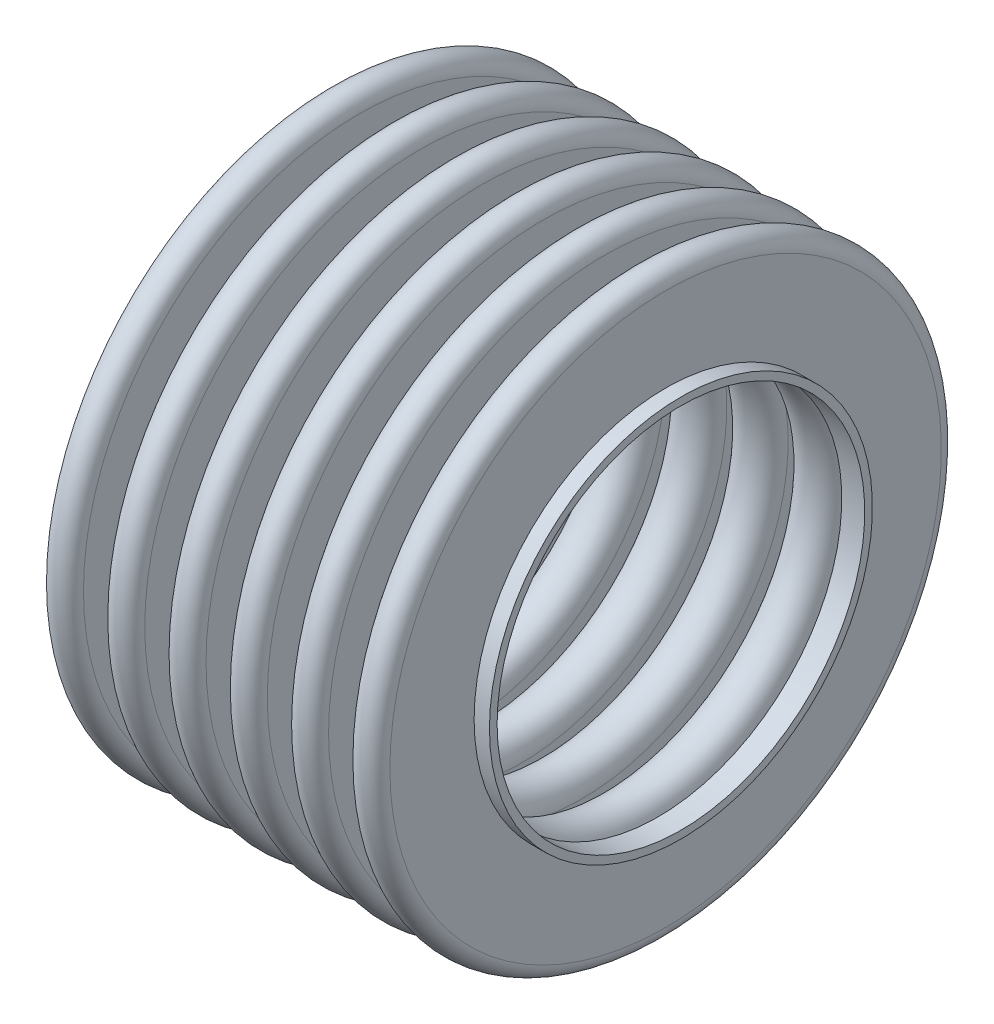
from build123d import *


with BuildPart() as part:
    # Sketch1 → Revolve1 (revolve)
    with BuildSketch(Plane.XY, mode=Mode.PRIVATE) as revolve1_sk:
        with BuildLine():
            Line((10, 6.25), (10, 6))
            Line((10, 6), (10.75, 6))
            Line((10.75, 6), (10.75, 9))
            ThreePointArc((10.75, 9), (11, 9.25), (11.25, 9))
            Line((11.25, 9), (11.25, 6.75))
            ThreePointArc((11.25, 6.75), (12, 6), (12.75, 6.75))
            Line((12.75, 6.75), (12.75, 9))
            ThreePointArc((12.75, 9), (13, 9.25), (13.25, 9))
            Line((13.25, 9), (13.25, 6.75))
            ThreePointArc((13.25, 6.75), (14, 6), (14.75, 6.75))
            Line((14.75, 6.75), (14.75, 9))
            ThreePointArc((14.75, 9), (15, 9.25), (15.25, 9))
            Line((15.25, 9), (15.25, 6.75))
            ThreePointArc((15.25, 6.75), (16, 6), (16.75, 6.75))
            Line((16.75, 6.75), (16.75, 9))
            ThreePointArc((16.75, 9), (17, 9.25), (17.25, 9))
            Line((17.25, 9), (17.25, 6.75))
            ThreePointArc((17.25, 6.75), (18, 6), (18.75, 6.75))
            Line((18.75, 6.75), (18.75, 9))
            ThreePointArc((18.75, 9), (19, 9.25), (19.25, 9))
            Line((19.25, 9), (19.25, 6.75))
            ThreePointArc((19.25, 6.75), (20, 6), (20.75, 6.75))
            Line((20.75, 6.75), (20.75, 9))
            ThreePointArc((20.75, 9), (21, 9.25), (21.25, 9))
            Line((21.25, 9), (21.25, 6))
            Line((21.25, 6), (22, 6))
            Line((22, 6), (22, 6.25))
            Line((22, 6.25), (21.5, 6.25))
            Line((21.5, 6.25), (21.5, 9))
            ThreePointArc((21.5, 9), (21, 9.5), (20.5, 9))
            Line((20.5, 9), (20.5, 6.75))
            ThreePointArc((20.5, 6.75), (20, 6.25), (19.5, 6.75))
            Line((19.5, 6.75), (19.5, 9))
            ThreePointArc((19.5, 9), (19, 9.5), (18.5, 9))
            Line((18.5, 9), (18.5, 6.75))
            ThreePointArc((18.5, 6.75), (18, 6.25), (17.5, 6.75))
            Line((17.5, 6.75), (17.5, 9))
            ThreePointArc((17.5, 9), (17, 9.5), (16.5, 9))
            Line((16.5, 9), (16.5, 6.75))
            ThreePointArc((16.5, 6.75), (16, 6.25), (15.5, 6.75))
            Line((15.5, 6.75), (15.5, 9))
            ThreePointArc((15.5, 9), (15, 9.5), (14.5, 9))
            Line((14.5, 9), (14.5, 6.75))
            ThreePointArc((14.5, 6.75), (14, 6.25), (13.5, 6.75))
            Line((13.5, 6.75), (13.5, 9))
            ThreePointArc((13.5, 9), (13, 9.5), (12.5, 9))
            Line((12.5, 9), (12.5, 6.75))
            ThreePointArc((12.5, 6.75), (12, 6.25), (11.5, 6.75))
            Line((11.5, 6.75), (11.5, 9))
            ThreePointArc((11.5, 9), (11, 9.5), (10.5, 9))
            Line((10.5, 9), (10.5, 6.25))
            Line((10.5, 6.25), (10, 6.25))
        make_face()
    revolve(revolve1_sk.sketch.rotate(Axis((22, 0, 0), (-1, 0, 0)), 270), axis=Axis((22, 0, 0), (-1, 0, 0)))


solid = part.part
